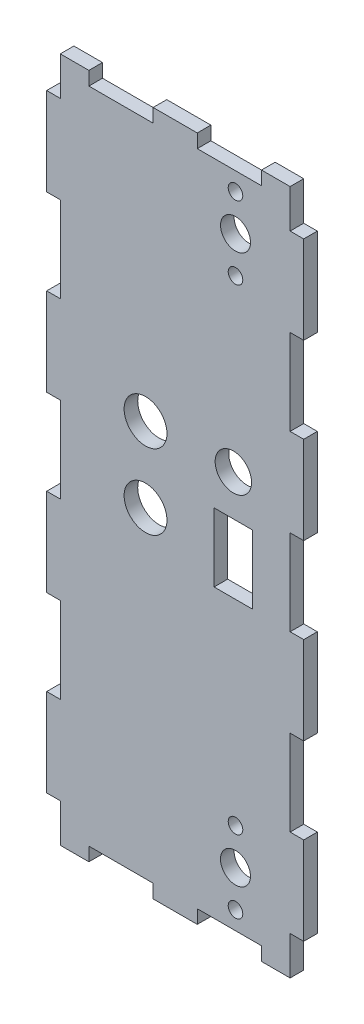
from build123d import *

# Parameters (mm, degrees)
SKETCH1_W           = 60
SKETCH1_H           = 160
BOSS_EXTRUDE1_DEPTH = 3.175
SKETCH4_W           = 3.175
SKETCH4_H           = 9
SKETCH4_H_2         = 20
SKETCH4_W_2         = 15
SKETCH4_H_3         = 3.175
CUT_EXTRUDE2_DEPTH  = 3.175
SKETCH5_R           = 3.5
SKETCH5_R_2         = 1.7
CUT_EXTRUDE3_DEPTH  = 3.175
SKETCH6_R           = 5
SKETCH6_R_2         = 4.25
SKETCH6_W           = 9
SKETCH6_H           = 16
CUT_EXTRUDE4_DEPTH  = 3.175


with BuildPart() as part:
    # Sketch1 → Boss-Extrude1 (new body)
    with BuildSketch(Plane.XY):
        with Locations((-26.825, 54.431521206)):
            Rectangle(SKETCH1_W, SKETCH1_H)
    extrude(amount=-BOSS_EXTRUDE1_DEPTH)

    # Sketch4 → Cut-Extrude2 (cut)
    with BuildSketch(Plane.XY):
        with Locations((1.5875, -21.068478794)):
            Rectangle(SKETCH4_W, SKETCH4_H)
        with Locations((1.5875, 13.931521206)):
            Rectangle(SKETCH4_W, SKETCH4_H_2)
        with Locations((1.5875, 54.431521206)):
            Rectangle(SKETCH4_W, SKETCH4_H_2)
        with Locations((1.5875, 94.931521206)):
            Rectangle(SKETCH4_W, SKETCH4_H_2)
        with Locations((1.5875, 129.931521206)):
            Rectangle(SKETCH4_W, SKETCH4_H)
        with Locations((-39.475, -23.980978794)):
            Rectangle(SKETCH4_W_2, SKETCH4_H_3)
        with Locations((-55.2375, 13.931521206)):
            Rectangle(SKETCH4_W, SKETCH4_H_2)
        with Locations((-55.2375, 54.431521206)):
            Rectangle(SKETCH4_W, SKETCH4_H_2)
        with Locations((-55.2375, 94.931521206)):
            Rectangle(SKETCH4_W, SKETCH4_H_2)
        with Locations((-55.2375, 129.931521206)):
            Rectangle(SKETCH4_W, SKETCH4_H)
        with Locations((-55.2375, -21.068478794)):
            Rectangle(SKETCH4_W, SKETCH4_H)
        with Locations((-14.175, -23.980978794)):
            Rectangle(SKETCH4_W_2, SKETCH4_H_3)
        with Locations((-14.175, 132.844021206)):
            Rectangle(SKETCH4_W_2, SKETCH4_H_3)
        with Locations((-39.475, 132.844021206)):
            Rectangle(SKETCH4_W_2, SKETCH4_H_3)
    extrude(amount=-CUT_EXTRUDE2_DEPTH, mode=Mode.SUBTRACT)

    # Sketch5 → Cut-Extrude3 (cut)
    with BuildSketch(Plane.XY):
        with Locations((-12.75, -9.643478794)):
            Circle(SKETCH5_R)
        with Locations((-12.75, -18.143478794)):
            Circle(SKETCH5_R_2)
        with Locations(Location((-12.75, -1.143478794, 0), (0, 0, 180))):
            Circle(SKETCH5_R_2)
        with Locations(Location((-12.75, 127.006521206, 0), (0, 0, 180))):
            Circle(SKETCH5_R_2)
        with Locations(Location((-12.75, 118.506521206, 0), (0, 0, 180))):
            Circle(SKETCH5_R)
        with Locations((-12.75, 110.006521206)):
            Circle(SKETCH5_R_2)
    extrude(amount=-CUT_EXTRUDE3_DEPTH, mode=Mode.SUBTRACT)

    # Sketch6 → Cut-Extrude4 (cut)
    with BuildSketch(Plane.XY):
        with Locations((-33.75, 52.606521206)):
            Circle(SKETCH6_R)
        with Locations((-13.25, 70.106521206)):
            Circle(SKETCH6_R_2)
        with Locations((-33.75, 70.106521206)):
            Circle(SKETCH6_R)
        with Locations((-13.25, 52.606521206)):
            Rectangle(SKETCH6_W, SKETCH6_H)
    extrude(amount=-CUT_EXTRUDE4_DEPTH, mode=Mode.SUBTRACT)


solid = part.part
